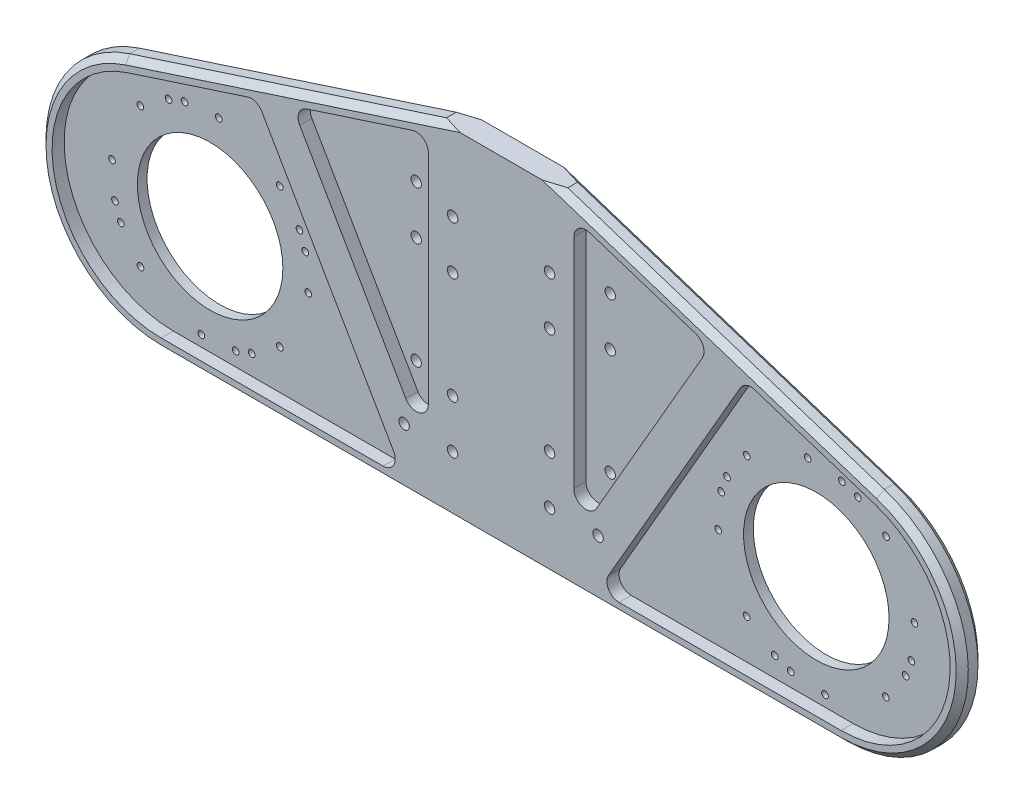
from build123d import *

# Parameters (mm, degrees)
SKETCH_1_R               = 60
EXTRUDE_1_DEPTH          = 8
FILLET_1_R               = 100
EXTRUDE_START            = 10
EXTRUDE_2_DEPTH          = 10
FILLET_2_R               = 10
CHAMFER_1_SIZE           = 5
CUT_EXTRUDE_1_DEPTH      = 514.758413114
CUT_EXTRUDE_1_DEPTH_BACK = 514.758413114
SKETCH_3_R               = 4.3
SKETCH_4_R               = 2.75
CUT_EXTRUDE_2_DEPTH      = 10
SKETCH_5_R               = 6
CUT_EXTRUDE_3_DEPTH      = 4


with BuildPart() as part:
    # 草图1 → 凸台-拉伸1 (new body)
    with BuildSketch(Plane.XY):
        Polygon((0, 0), (-100, 0), (-961.751390409, 0), (-100, 280), (0, 280), (861.751390409, 0), align=None)
        with Locations((200, 100)):
            Circle(SKETCH_1_R, mode=Mode.SUBTRACT)
        with Locations((-300, 100)):
            Circle(SKETCH_1_R, mode=Mode.SUBTRACT)
    extrude(amount=EXTRUDE_1_DEPTH)

    # 圆角1
    fillet_1_edges = [part.edges().sort_by_distance(p)[0] for p in [
        (-961.751390409, 0, 4),
        (861.751390409, 0, 4),
    ]]
    fillet(fillet_1_edges, radius=FILLET_1_R)

    # 草图2 → 凸台-拉伸2 (add)
    # profile 1 of 2: a face of its own
    with BuildSketch(Plane.XY.offset(8).offset(EXTRUDE_START)):
        with BuildLine():
            Line((-50, 0), (-50, 280))
            Line((-50, 280), (-100, 280))
            Line((-100, 280), (-361.277938379, 195.10565163))
            ThreePointArc((-361.277938379, 195.10565163), (-429.145073001, 84.356553496), (-330.376238942, 0))
            Line((-330.376238942, 0), (-50, 0))
        make_face()
        with BuildLine():
            Line((-358.187768435, 185.595086467), (-251.410485182, 220.289128906))
            Line((-251.410485182, 220.289128906), (-130, 10))
            Line((-130, 10), (-330.376238942, 10))
            ThreePointArc((-330.376238942, 10), (-419.268189595, 85.920898146), (-358.187768435, 185.595086467))
        make_face(mode=Mode.SUBTRACT)
        Polygon((-110, 266.236180795), (-110, 35.358983849), (-222.241374643, 229.766747442), align=None, mode=Mode.SUBTRACT)
    # profile 2 of 2: a face of its own
    with BuildSketch(Plane.XY.offset(8).offset(EXTRUDE_START)):
        with BuildLine():
            Line((261.277938379, 195.10565163), (0, 280))
            Line((0, 280), (-50, 280))
            Line((-50, 280), (-50, 0))
            Line((-50, 0), (230.376238942, 0))
            ThreePointArc((230.376238942, 0), (329.145073001, 84.356553496), (261.277938379, 195.10565163))
        make_face()
        with BuildLine():
            Line((230.376238942, 10), (30, 10))
            Line((30, 10), (151.410485182, 220.289128906))
            Line((151.410485182, 220.289128906), (258.187768435, 185.595086467))
            ThreePointArc((258.187768435, 185.595086467), (319.268189595, 85.920898146), (230.376238942, 10))
        make_face(mode=Mode.SUBTRACT)
        Polygon((10, 35.358983849), (10, 266.236180795), (122.241374643, 229.766747442), align=None, mode=Mode.SUBTRACT)
    extrude(amount=-EXTRUDE_2_DEPTH)

    # 圆角2
    fillet_2_edges = [part.edges().sort_by_distance(p)[0] for p in [
        (122.241374643, 229.766747442, 13),
        (10, 35.358983849, 13),
        (30, 10, 13),
        (-130, 10, 13),
        (-222.241374643, 229.766747442, 13),
        (-110, 266.236180795, 13),
        (151.410485182, 220.289128906, 13),
        (-251.410485182, 220.289128906, 13),
        (-110, 35.358983849, 13),
        (10, 266.236180795, 13),
    ]]
    fillet(fillet_2_edges, radius=FILLET_2_R)

    # 倒角1
    chamfer_1_edges = [part.edges().sort_by_distance(p)[0] for p in [
        (130.63896919, 237.552825815, 0),
        (-50, 0, 0),
        (329.145073001, 84.356553496, 0),
        (-429.145073001, 84.356553496, 0),
        (-50, 0, 18),
        (329.145073001, 84.356553496, 18),
        (130.63896919, 237.552825815, 18),
        (-230.63896919, 237.552825815, 18),
        (-429.145073001, 84.356553496, 18),
        (-230.63896919, 237.552825815, 0),
    ]]
    chamfer(chamfer_1_edges, length=CHAMFER_1_SIZE)

    # 草图3 → 切除-拉伸1 (cut, two sides: drawn at the far end of the back side and taken through both)
    with BuildSketch(Plane(origin=(0, 0, 0), x_dir=(-1, 0, 0), z_dir=(0, 0, -1)).offset(-CUT_EXTRUDE_1_DEPTH_BACK)):
        with Locations((-30, 217)):
            Circle(SKETCH_3_R)
        with Locations((-30, 177)):
            Circle(SKETCH_3_R)
        with Locations((10, 217)):
            Circle(SKETCH_3_R)
        with Locations((10, 177)):
            Circle(SKETCH_3_R)
        with Locations((-30, 89)):
            Circle(SKETCH_3_R)
        with Locations((10, 89)):
            Circle(SKETCH_3_R)
        with Locations((-30, 49)):
            Circle(SKETCH_3_R)
        with Locations((10, 49)):
            Circle(SKETCH_3_R)
        with Locations(Location((90, 49, 0), (0, 0, 180))):
            Circle(SKETCH_3_R)
        with Locations(Location((130, 49, 0), (0, 0, 180))):
            Circle(SKETCH_3_R)
        with Locations(Location((90, 89, 0), (0, 0, 180))):
            Circle(SKETCH_3_R)
        with Locations(Location((130, 89, 0), (0, 0, 180))):
            Circle(SKETCH_3_R)
        with Locations(Location((90, 177, 0), (0, 0, 180))):
            Circle(SKETCH_3_R)
        with Locations(Location((90, 217, 0), (0, 0, 180))):
            Circle(SKETCH_3_R)
        with Locations(Location((130, 177, 0), (0, 0, 180))):
            Circle(SKETCH_3_R)
        with Locations(Location((130, 217, 0), (0, 0, 180))):
            Circle(SKETCH_3_R)
    extrude(amount=CUT_EXTRUDE_1_DEPTH + CUT_EXTRUDE_1_DEPTH_BACK, mode=Mode.SUBTRACT)

    # 草图4 → 切除-拉伸2 (cut)
    with BuildSketch(Plane.XY.offset(8)):
        with Locations((257.390001682, 42.485217492)):
            Circle(SKETCH_4_R)
        with Locations((273.674753309, 65.742253069)):
            Circle(SKETCH_4_R)
        with Locations((278.458590634, 78.885738097)):
            Circle(SKETCH_4_R)
        with Locations((280.933081449, 107.169297536)):
            Circle(SKETCH_4_R)
        with Locations((257.514782508, 157.390001682)):
            Circle(SKETCH_4_R)
        with Locations((234.257746931, 173.674753309)):
            Circle(SKETCH_4_R)
        with Locations((221.114261903, 178.458590634)):
            Circle(SKETCH_4_R)
        with Locations((192.830702464, 180.933081449)):
            Circle(SKETCH_4_R)
        with Locations((142.609998318, 157.514782508)):
            Circle(SKETCH_4_R)
        with Locations((126.325246691, 134.257746931)):
            Circle(SKETCH_4_R)
        with Locations((121.541409366, 121.114261903)):
            Circle(SKETCH_4_R)
        with Locations((119.066918551, 92.830702464)):
            Circle(SKETCH_4_R)
        with Locations((142.485217492, 42.609998318)):
            Circle(SKETCH_4_R)
        with Locations((165.742253069, 26.325246691)):
            Circle(SKETCH_4_R)
        with Locations((178.885738097, 21.541409366)):
            Circle(SKETCH_4_R)
        with Locations((-242.485217492, 42.609998318)):
            Circle(SKETCH_4_R)
        with Locations((-265.742253069, 26.325246691)):
            Circle(SKETCH_4_R)
        with Locations((-278.885738097, 21.541409366)):
            Circle(SKETCH_4_R)
        with Locations((-307.169297536, 19.066918551)):
            Circle(SKETCH_4_R)
        with Locations((-357.390001682, 42.485217492)):
            Circle(SKETCH_4_R)
        with Locations((-373.674753309, 65.742253069)):
            Circle(SKETCH_4_R)
        with Locations((-378.458590634, 78.885738097)):
            Circle(SKETCH_4_R)
        with Locations((-380.933081449, 107.169297536)):
            Circle(SKETCH_4_R)
        with Locations((-357.514782508, 157.390001682)):
            Circle(SKETCH_4_R)
        with Locations((-334.257746931, 173.674753309)):
            Circle(SKETCH_4_R)
        with Locations((-321.114261903, 178.458590634)):
            Circle(SKETCH_4_R)
        with Locations((-292.830702464, 180.933081449)):
            Circle(SKETCH_4_R)
        with Locations((-242.609998318, 157.514782508)):
            Circle(SKETCH_4_R)
        with Locations((-226.325246691, 134.257746931)):
            Circle(SKETCH_4_R)
        with Locations((-221.541409366, 121.114261903)):
            Circle(SKETCH_4_R)
        with Locations((-219.066918551, 92.830702464)):
            Circle(SKETCH_4_R)
        with Locations((207.169297536, 19.066918551)):
            Circle(SKETCH_4_R)
    extrude(amount=-CUT_EXTRUDE_2_DEPTH, mode=Mode.SUBTRACT)

    # 草图5 → 切除-拉伸3 (cut)
    with BuildSketch(Plane(origin=(0, 0, 0), x_dir=(-1, 0, 0), z_dir=(0, 0, -1))):
        with Locations((-192.830702464, 180.933081449)):
            Circle(SKETCH_5_R)
        with Locations((-142.609998318, 157.514782508)):
            Circle(SKETCH_5_R)
        with Locations((-126.325246691, 134.257746931)):
            Circle(SKETCH_5_R)
        with Locations((-121.541409366, 121.114261903)):
            Circle(SKETCH_5_R)
        with Locations((-119.066918551, 92.830702464)):
            Circle(SKETCH_5_R)
        with Locations((-142.485217492, 42.609998318)):
            Circle(SKETCH_5_R)
        with Locations((-165.742253069, 26.325246691)):
            Circle(SKETCH_5_R)
        with Locations((-178.885738097, 21.541409366)):
            Circle(SKETCH_5_R)
        with Locations((-207.169297536, 19.066918551)):
            Circle(SKETCH_5_R)
        with Locations((-257.390001682, 42.485217492)):
            Circle(SKETCH_5_R)
        with Locations((-273.674753309, 65.742253069)):
            Circle(SKETCH_5_R)
        with Locations((-278.458590634, 78.885738097)):
            Circle(SKETCH_5_R)
        with Locations((-280.933081449, 107.169297536)):
            Circle(SKETCH_5_R)
        with Locations((-257.514782508, 157.390001682)):
            Circle(SKETCH_5_R)
        with Locations((-234.257746931, 173.674753309)):
            Circle(SKETCH_5_R)
        with Locations((-221.114261903, 178.458590634)):
            Circle(SKETCH_5_R)
        with Locations(Location((321.114261903, 178.458590634, 0), (0, 0, 180))):
            Circle(SKETCH_5_R)
        with Locations(Location((334.257746931, 173.674753309, 0), (0, 0, 180))):
            Circle(SKETCH_5_R)
        with Locations(Location((357.514782508, 157.390001682, 0), (0, 0, 180))):
            Circle(SKETCH_5_R)
        with Locations(Location((380.933081449, 107.169297536, 0), (0, 0, 180))):
            Circle(SKETCH_5_R)
        with Locations(Location((378.458590634, 78.885738097, 0), (0, 0, 180))):
            Circle(SKETCH_5_R)
        with Locations(Location((373.674753309, 65.742253069, 0), (0, 0, 180))):
            Circle(SKETCH_5_R)
        with Locations(Location((357.390001682, 42.485217492, 0), (0, 0, 180))):
            Circle(SKETCH_5_R)
        with Locations(Location((307.169297536, 19.066918551, 0), (0, 0, 180))):
            Circle(SKETCH_5_R)
        with Locations(Location((278.885738097, 21.541409366, 0), (0, 0, 180))):
            Circle(SKETCH_5_R)
        with Locations(Location((265.742253069, 26.325246691, 0), (0, 0, 180))):
            Circle(SKETCH_5_R)
        with Locations(Location((242.485217492, 42.609998318, 0), (0, 0, 180))):
            Circle(SKETCH_5_R)
        with Locations(Location((219.066918551, 92.830702464, 0), (0, 0, 180))):
            Circle(SKETCH_5_R)
        with Locations(Location((221.541409366, 121.114261903, 0), (0, 0, 180))):
            Circle(SKETCH_5_R)
        with Locations(Location((226.325246691, 134.257746931, 0), (0, 0, 180))):
            Circle(SKETCH_5_R)
        with Locations(Location((242.609998318, 157.514782508, 0), (0, 0, 180))):
            Circle(SKETCH_5_R)
        with Locations(Location((292.830702464, 180.933081449, 0), (0, 0, 180))):
            Circle(SKETCH_5_R)
    extrude(amount=-CUT_EXTRUDE_3_DEPTH, mode=Mode.SUBTRACT)


solid = part.part
